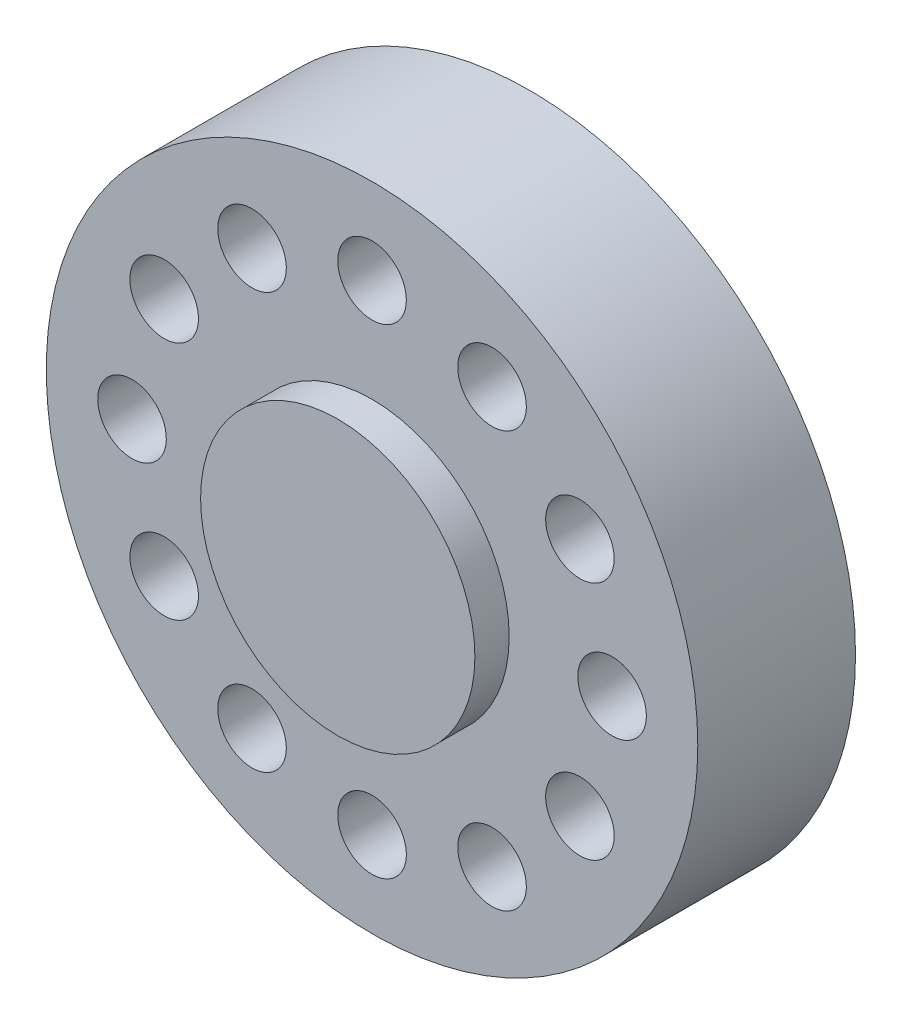
from build123d import *

# Parameters (mm, degrees)
ESQUISSE1_R                  = 9.5
BOSS_EXTRU_1_DEPTH           = 4.6
R_P_TITION_CIRCULAIRE1_COUNT = 12
ESQUISSE2_R                  = 4
BOSS_EXTRU_4_DEPTH           = 1
ESQUISSE7_R                  = 1
ENL_V_MAT_EXTRU_1_DEPTH      = 4.6
R_P_TITION_CIRCULAIRE2_COUNT = 12


with BuildPart() as part:
    # Esquisse1 → Boss.-Extru.1 (new body)
    with BuildSketch(Plane.XY):
        with Locations((-16.758163119, 25.761769115)):
            Circle(ESQUISSE1_R)
    boss_extru_1 = extrude(amount=BOSS_EXTRU_1_DEPTH)


with BuildPart() as r_p_tition_circulaire1_1:
    # Répétition circulaire1: pattern copy
    add(boss_extru_1.rotate(Axis((-16.758163119, 25.761769115, 4.6), (0, 0, 1)), 1 * 360 / R_P_TITION_CIRCULAIRE1_COUNT))


with BuildPart() as r_p_tition_circulaire1_2:
    # Répétition circulaire1: pattern copy
    add(boss_extru_1.rotate(Axis((-16.758163119, 25.761769115, 4.6), (0, 0, 1)), 2 * 360 / R_P_TITION_CIRCULAIRE1_COUNT))


with BuildPart() as r_p_tition_circulaire1_3:
    # Répétition circulaire1: pattern copy
    add(boss_extru_1.rotate(Axis((-16.758163119, 25.761769115, 4.6), (0, 0, 1)), 3 * 360 / R_P_TITION_CIRCULAIRE1_COUNT))


with BuildPart() as r_p_tition_circulaire1_4:
    # Répétition circulaire1: pattern copy
    add(boss_extru_1.rotate(Axis((-16.758163119, 25.761769115, 4.6), (0, 0, 1)), 4 * 360 / R_P_TITION_CIRCULAIRE1_COUNT))


with BuildPart() as r_p_tition_circulaire1_5:
    # Répétition circulaire1: pattern copy
    add(boss_extru_1.rotate(Axis((-16.758163119, 25.761769115, 4.6), (0, 0, 1)), 5 * 360 / R_P_TITION_CIRCULAIRE1_COUNT))


with BuildPart() as r_p_tition_circulaire1_6:
    # Répétition circulaire1: pattern copy
    add(boss_extru_1.rotate(Axis((-16.758163119, 25.761769115, 4.6), (0, 0, 1)), 6 * 360 / R_P_TITION_CIRCULAIRE1_COUNT))


with BuildPart() as r_p_tition_circulaire1_7:
    # Répétition circulaire1: pattern copy
    add(boss_extru_1.rotate(Axis((-16.758163119, 25.761769115, 4.6), (0, 0, 1)), 7 * 360 / R_P_TITION_CIRCULAIRE1_COUNT))


with BuildPart() as r_p_tition_circulaire1_8:
    # Répétition circulaire1: pattern copy
    add(boss_extru_1.rotate(Axis((-16.758163119, 25.761769115, 4.6), (0, 0, 1)), 8 * 360 / R_P_TITION_CIRCULAIRE1_COUNT))


with BuildPart() as r_p_tition_circulaire1_9:
    # Répétition circulaire1: pattern copy
    add(boss_extru_1.rotate(Axis((-16.758163119, 25.761769115, 4.6), (0, 0, 1)), 9 * 360 / R_P_TITION_CIRCULAIRE1_COUNT))


with BuildPart() as r_p_tition_circulaire1_10:
    # Répétition circulaire1: pattern copy
    add(boss_extru_1.rotate(Axis((-16.758163119, 25.761769115, 4.6), (0, 0, 1)), 10 * 360 / R_P_TITION_CIRCULAIRE1_COUNT))


with BuildPart() as r_p_tition_circulaire1_11:
    # Répétition circulaire1: pattern copy
    add(boss_extru_1.rotate(Axis((-16.758163119, 25.761769115, 4.6), (0, 0, 1)), 11 * 360 / R_P_TITION_CIRCULAIRE1_COUNT))


with BuildPart() as part_1:
    add(part.part)

    # Répétition circulaire1 united with what: union Répétition circulaire1_1, Répétition circulaire1_2, Répétition circulaire1_3, Répétition circulaire1_4, Répétition circulaire1_5, Répétition circulaire1_6, Répétition circulaire1_7, Répétition circulaire1_8, Répétition circulaire1_9, Répétition circulaire1_10, Répétition circulaire1_11
    add(r_p_tition_circulaire1_1.part)
    add(r_p_tition_circulaire1_2.part)
    add(r_p_tition_circulaire1_3.part)
    add(r_p_tition_circulaire1_4.part)
    add(r_p_tition_circulaire1_5.part)
    add(r_p_tition_circulaire1_6.part)
    add(r_p_tition_circulaire1_7.part)
    add(r_p_tition_circulaire1_8.part)
    add(r_p_tition_circulaire1_9.part)
    add(r_p_tition_circulaire1_10.part)
    add(r_p_tition_circulaire1_11.part)

    # Esquisse2 → Boss.-Extru.4 (add)
    with BuildSketch(Plane.XY.offset(4.6)):
        with Locations((-16.758163119, 25.761769115)):
            Circle(ESQUISSE2_R)
    extrude(amount=BOSS_EXTRU_4_DEPTH)

    # Esquisse7 → Enlèv. mat.-Extru.1 (cut)
    with BuildSketch(Plane.XY.offset(4.6)):
        with Locations((-16.758163119, 32.761769115)):
            Circle(ESQUISSE7_R)
    enl_v_mat_extru_1 = extrude(amount=-ENL_V_MAT_EXTRU_1_DEPTH, mode=Mode.SUBTRACT)

    # Répétition circulaire2: Enlèv. mat.-Extru.1 ×12 about axis
    r_p_tition_circulaire2_axis = Axis((-16.758163119, 25.761769115, 0), (0, 0, 1))
    for i in range(1, R_P_TITION_CIRCULAIRE2_COUNT):
        add(enl_v_mat_extru_1.rotate(r_p_tition_circulaire2_axis, i * 360 / R_P_TITION_CIRCULAIRE2_COUNT), mode=Mode.SUBTRACT)


solid = part_1.part
